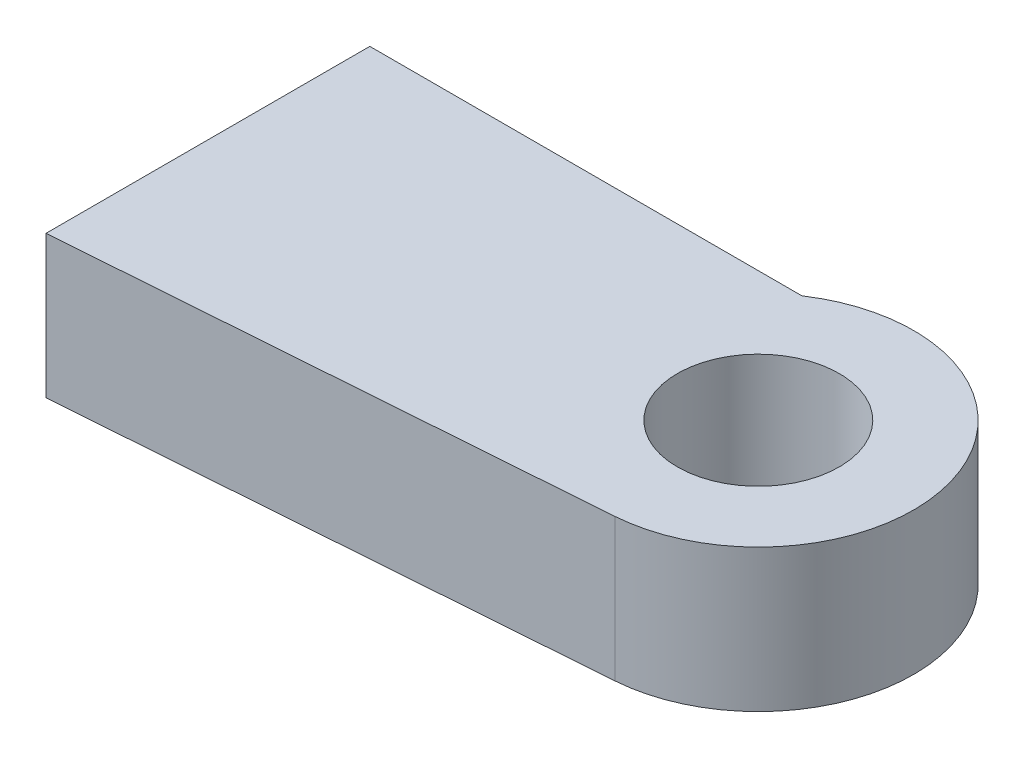
from build123d import *

# Parameters (mm, degrees)
SKETCH2_R           = 5
BOSS_EXTRUDE1_DEPTH = 8.8


with BuildPart() as part:
    # Sketch2 → Boss-Extrude1 (new body)
    with BuildSketch(Plane(origin=(0, 0, 0), x_dir=(1, 0, 0), z_dir=(0, 1, 0))):
        with BuildLine():
            Line((0, 0), (0, 20))
            Line((0, 20), (26.689986451, 20))
            ThreePointArc((26.689986451, 20), (41.079007087, 15.109602755), (32.706796819, 2.426306838))
            Line((32.706796819, 2.426306838), (0, 0))
        make_face()
        with Locations(Location((31.996586115, 12, 0), (0, 0, 270))):
            Circle(SKETCH2_R, mode=Mode.SUBTRACT)
    extrude(amount=BOSS_EXTRUDE1_DEPTH)


solid = part.part
